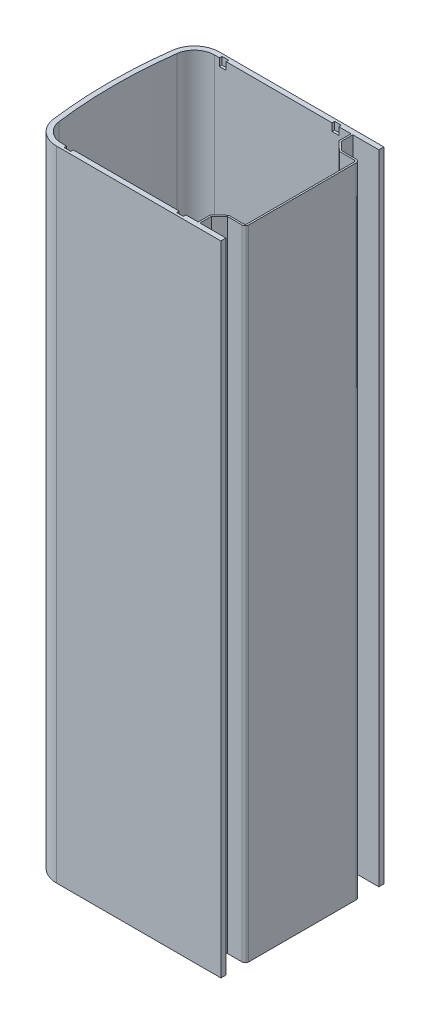
from build123d import *

# Parameters (mm, degrees)
BOSS_EXTRUDE1_DEPTH = 380
SKETCH2_W           = 4
SKETCH2_H           = 9
CUT_EXTRUDE1_DEPTH  = 1.5
BOSS_EXTRUDE2_DEPTH = 380


with BuildPart() as part:
    # Sketch1 → Boss-Extrude1 (new body)
    with BuildSketch(Plane(origin=(0, 0, 0), x_dir=(1, 0, 0), z_dir=(0, 1, 0))):
        with BuildLine():
            Line((0, 48.5), (-97.832794656, 48.5))
            ThreePointArc((-97.832794656, 48.5), (-107.732532415, 44.769214361), (-112.707763578, 35.432692308))
            ThreePointArc((-112.707763578, 35.432692308), (-115, 0), (-112.707763578, -35.432692308))
            ThreePointArc((-112.707763578, -35.432692308), (-107.732532415, -44.769214361), (-97.832794656, -48.5))
            Line((-97.832794656, -48.5), (0, -48.5))
            Line((0, -48.5), (0, -45.5))
            Line((0, -45.5), (-97.832794656, -45.5))
            ThreePointArc((-97.832794656, -45.5), (-105.752584863, -42.515371489), (-109.732769794, -35.046153846))
            ThreePointArc((-109.732769794, -35.046153846), (-112, 0), (-109.732769794, 35.046153846))
            ThreePointArc((-109.732769794, 35.046153846), (-105.752584863, 42.515371489), (-97.832794656, 45.5))
            Line((-97.832794656, 45.5), (0, 45.5))
            Line((0, 45.5), (0, 48.5))
        make_face()
    extrude(amount=BOSS_EXTRUDE1_DEPTH)

    # Sketch2 → Cut-Extrude1 (cut)
    with BuildSketch(Plane.XY.offset(-45.5)):
        with Locations((-92.832794656, 380)):
            Rectangle(SKETCH2_W, SKETCH2_H)
        with Locations((-25.832794656, 380)):
            Rectangle(SKETCH2_W, SKETCH2_H)
    cut_extrude1 = extrude(amount=-CUT_EXTRUDE1_DEPTH, mode=Mode.SUBTRACT)

    # Mirror1: Cut-Extrude1 across plane
    add(cut_extrude1.mirror(Plane.XY), mode=Mode.SUBTRACT)

    # Sketch3 → Boss-Extrude2 (add)
    with BuildSketch(Plane(origin=(0, 0, 0), x_dir=(1, 0, 0), z_dir=(0, 1, 0))):
        with BuildLine():
            Line((0, 0), (0, 31.952645856))
            ThreePointArc((0, 31.952645856), (-0.585786438, 33.366859418), (-2, 33.952645856))
            Line((-2, 33.952645856), (-10.490338609, 33.952645856))
            Line((-10.490338609, 33.952645856), (-15.497576902, 38.606995774))
            Line((-15.497576902, 38.606995774), (-15.497576902, 45.5))
            Line((-15.497576902, 45.5), (-16.497576902, 45.5))
            Line((-16.497576902, 45.5), (-16.497576902, 38.171230588))
            Line((-16.497576902, 38.171230588), (-10.88332405, 32.952645856))
            Line((-10.88332405, 32.952645856), (-2, 32.952645856))
            ThreePointArc((-2, 32.952645856), (-1.292893219, 32.659752637), (-1, 31.952645856))
            Line((-1, 31.952645856), (-1, 0))
            Line((-1, 0), (-1, -31.952645856))
            ThreePointArc((-1, -31.952645856), (-1.292893219, -32.659752637), (-2, -32.952645856))
            Line((-2, -32.952645856), (-10.88332405, -32.952645856))
            Line((-10.88332405, -32.952645856), (-16.497576902, -38.171230588))
            Line((-16.497576902, -38.171230588), (-16.497576902, -45.5))
            Line((-16.497576902, -45.5), (-15.497576902, -45.5))
            Line((-15.497576902, -45.5), (-15.497576902, -38.606995774))
            Line((-15.497576902, -38.606995774), (-10.490338609, -33.952645856))
            Line((-10.490338609, -33.952645856), (-2, -33.952645856))
            ThreePointArc((-2, -33.952645856), (-0.585786438, -33.366859418), (0, -31.952645856))
            Line((0, -31.952645856), (0, 0))
        make_face()
    extrude(amount=BOSS_EXTRUDE2_DEPTH)


solid = part.part
